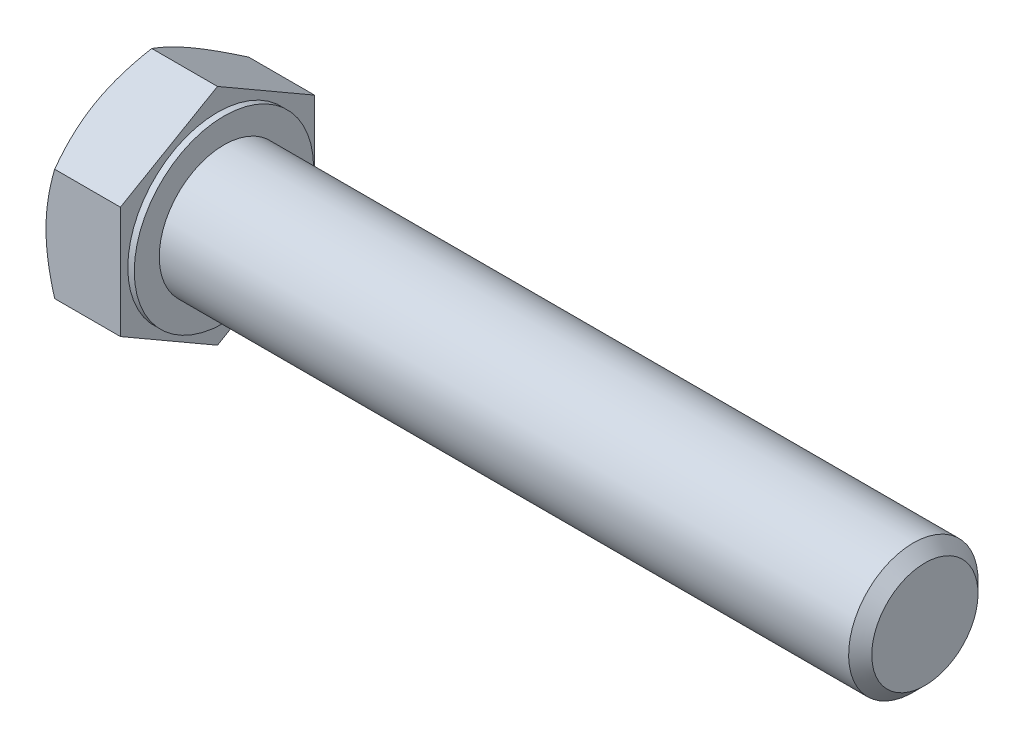
from build123d import *

# Parameters (mm, degrees)
EXTRUDE_559_DEPTH = 6.9
CHAMFER_2_SIZE    = 1.0735375
CHAMFER_2_SIZE2   = 1.0736375


with BuildPart() as part:
    # 草圖1 → Revolve 409 (revolve)
    with BuildSketch(Plane.XY):
        Polygon((-0.6001, 0), (65, 0), (65, 6), (35, 6), (33.9263625, 6), (0, 6), (0, 8.315), (-0.6001, 8.315), align=None)
    revolve(axis=Axis((65, 0, 0), (-1, 0, 0)))

    # 草圖2 → Extrude 559 (add)
    with BuildSketch(Plane.ZY.offset(0.6001)):
        Polygon((0, 10.392304845), (9, 5.196152423), (9, -5.196152423), (0, -10.392304845), (-9, -5.196152423), (-9, 5.196152423), align=None)
    extrude(amount=EXTRUDE_559_DEPTH)

    # 草圖3 → Cut-Revolve 680 (revolve, cut)
    with BuildSketch(Plane.XY):
        Polygon((-7.5001, 9), (-7.5001, 10.392304845), (-6.696252423, 10.392304845), align=None)
    revolve(axis=Axis((-8.8801, 0, 0), (1, 0, 0)), mode=Mode.SUBTRACT)

    # 倒角2
    chamfer_2_edges = [part.edges().sort_by_distance(p)[0] for p in [
        (65, -6, 0),
    ]]
    chamfer_2_side = [part.faces().sort_by_distance(p)[0] for p in [
        (32.5, -6, 0),
    ]]
    chamfer(chamfer_2_edges, length=CHAMFER_2_SIZE, length2=CHAMFER_2_SIZE2, reference=chamfer_2_side[0])


solid = part.part
